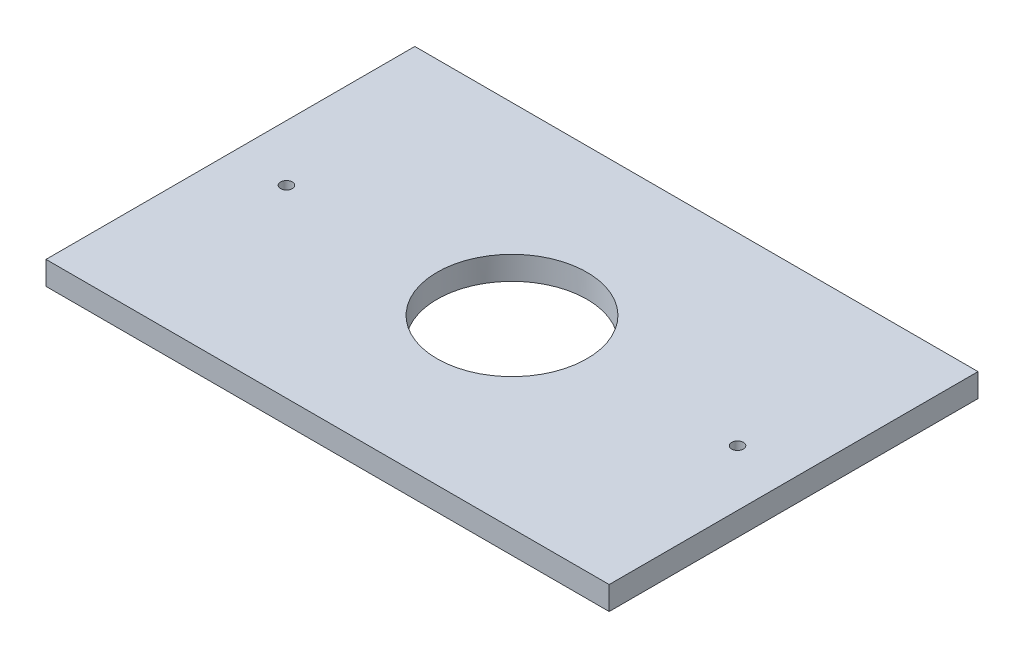
from build123d import *

# Parameters (mm, degrees)
SKETCH1_W           = 152.7
SKETCH1_H           = 100
BOSS_EXTRUDE1_DEPTH = 6.35
SKETCH2_R           = 20.32
CUT_EXTRUDE1_DEPTH  = 10
SKETCH3_R           = 1.5875
CUT_EXTRUDE2_DEPTH  = 10


with BuildPart() as part:
    # Sketch1 → Boss-Extrude1 (new body)
    with BuildSketch(Plane(origin=(0, 0, 0), x_dir=(1, 0, 0), z_dir=(0, 1, 0))):
        with Locations((76.35, 50)):
            Rectangle(SKETCH1_W, SKETCH1_H)
    extrude(amount=BOSS_EXTRUDE1_DEPTH)

    # Sketch2 → Cut-Extrude1 (cut)
    with BuildSketch(Plane(origin=(0, 6.35, 0), x_dir=(1, 0, 0), z_dir=(0, 1, 0))):
        with Locations(Location((76.35, 50, 0), (0, 0, 270))):
            Circle(SKETCH2_R)
    extrude(amount=-CUT_EXTRUDE1_DEPTH, mode=Mode.SUBTRACT)

    # Sketch3 → Cut-Extrude2 (cut)
    with BuildSketch(Plane(origin=(0, 6.35, 0), x_dir=(1, 0, 0), z_dir=(0, 1, 0))):
        with Locations(Location((15.2, 50, 0), (0, 0, 270))):
            Circle(SKETCH3_R)
        with Locations(Location((137.5, 50, 0), (0, 0, 270))):
            Circle(SKETCH3_R)
    extrude(amount=-CUT_EXTRUDE2_DEPTH, mode=Mode.SUBTRACT)


solid = part.part
